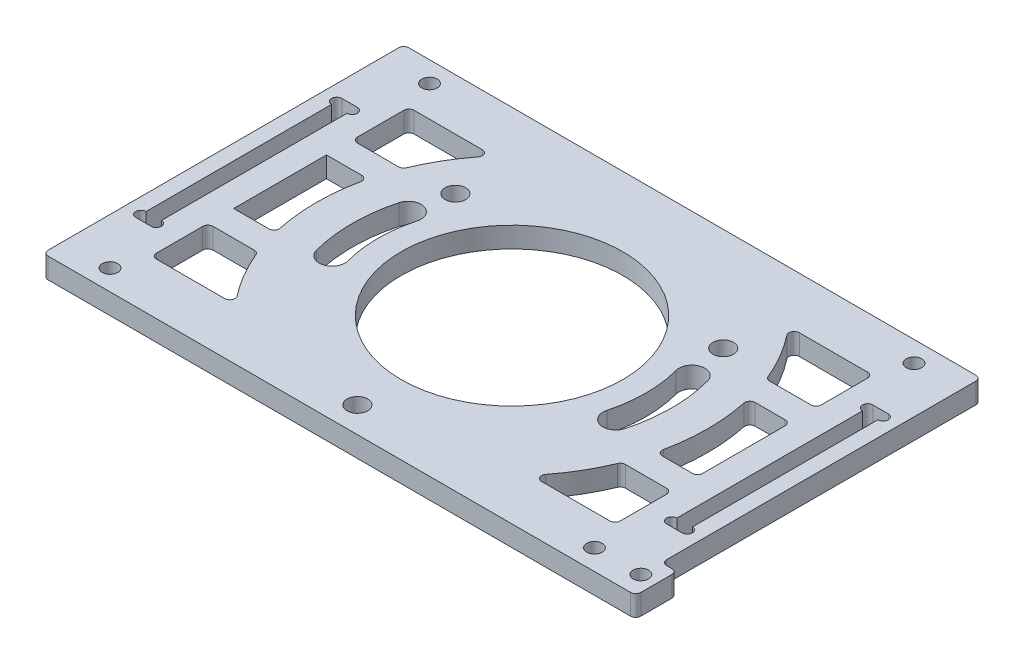
from build123d import *

# Parameters (mm, degrees)
SKETCH_1_W          = 112
SKETCH_1_H          = 70
SKETCH_1_W_2        = 3
SKETCH_1_H_2        = 40
EXTRUDE_1_DEPTH     = 4
SKETCH_6_R          = 21.5
SKETCH_6_R_2        = 2
CUT_EXTRUDE_5_DEPTH = 67.158899628
SKETCH_2_R          = 1.5
CUT_EXTRUDE_1_DEPTH = 10
SKETCH_4_R          = 1
CUT_EXTRUDE_3_DEPTH = 67.158899628
CUT_EXTRUDE_6_DEPTH = 67.158899628
SKETCH_8_W          = 3
SKETCH_8_H          = 8
EXTRUDE_2_DEPTH     = 4
SKETCH_9_R          = 1.5
CUT_EXTRUDE_7_DEPTH = 69.71681017
FILLET_3_R          = 1


with BuildPart() as part:
    # 草图1 → 凸台-拉伸1 (new body)
    with BuildSketch(Plane(origin=(0, 0, 0), x_dir=(1, 0, 0), z_dir=(0, 1, 0))):
        Rectangle(SKETCH_1_W, SKETCH_1_H)
        with Locations((-51.5, 0)):
            Rectangle(SKETCH_1_W_2, SKETCH_1_H_2, mode=Mode.SUBTRACT)
        with Locations((51.5, 0)):
            Rectangle(SKETCH_1_W_2, SKETCH_1_H_2, mode=Mode.SUBTRACT)
    extrude(amount=EXTRUDE_1_DEPTH)

    # 草图6 → 切除-拉伸5 (cut, through all)
    with BuildSketch(Plane(origin=(0, 4, 0), x_dir=(1, 0, 0), z_dir=(0, 1, 0))):
        with Locations(Location((0, 0, 0), (0, 0, 270))):
            Circle(SKETCH_6_R)
        with Locations(Location((-25.980762114, 15, 0), (0, 0, 270))):
            Circle(SKETCH_6_R_2)
        with Locations(Location((25.980762114, 15, 0), (0, 0, 270))):
            Circle(SKETCH_6_R_2)
        with Locations(Location((0, -30, 0), (0, 0, 270))):
            Circle(SKETCH_6_R_2)
        with BuildLine():
            ThreePointArc((-29.943700615, 8.023390398), (-31, 0), (-29.943700615, -8.023390398))
            ThreePointArc((-29.943700615, -8.023390398), (-26.881838436, -9.791157351), (-25.114071484, -6.729295173))
            ThreePointArc((-25.114071484, -6.729295173), (-26, 0), (-25.114071484, 6.729295173))
            ThreePointArc((-25.114071484, 6.729295173), (-26.881838436, 9.791157351), (-29.943700615, 8.023390398))
        make_face()
        with BuildLine():
            ThreePointArc((29.943700615, 8.023390398), (31, 0), (29.943700615, -8.023390398))
            ThreePointArc((29.943700615, -8.023390398), (26.881838436, -9.791157351), (25.114071484, -6.729295173))
            ThreePointArc((25.114071484, -6.729295173), (26, 0), (25.114071484, 6.729295173))
            ThreePointArc((25.114071484, 6.729295173), (26.881838436, 9.791157351), (29.943700615, 8.023390398))
        make_face()
    extrude(amount=-CUT_EXTRUDE_5_DEPTH, mode=Mode.SUBTRACT)

    # 草图2 → 切除-拉伸1 (cut)
    with BuildSketch(Plane(origin=(0, 4, 0), x_dir=(1, 0, 0), z_dir=(0, 1, 0))):
        with Locations(Location((-47, 31, 0), (0, 0, 270))):
            Circle(SKETCH_2_R)
        with Locations(Location((47, 31, 0), (0, 0, 270))):
            Circle(SKETCH_2_R)
        with Locations(Location((47, -31, 0), (0, 0, 270))):
            Circle(SKETCH_2_R)
        with Locations(Location((-47, -31, 0), (0, 0, 270))):
            Circle(SKETCH_2_R)
    extrude(amount=-CUT_EXTRUDE_1_DEPTH, mode=Mode.SUBTRACT)

    # 草图4 → 切除-拉伸3 (cut, through all)
    with BuildSketch(Plane.XZ.offset(-4)):
        with Locations((-50, 19)):
            Circle(SKETCH_4_R)
        with Locations((-50, -19)):
            Circle(SKETCH_4_R)
        with Locations((50, -19)):
            Circle(SKETCH_4_R)
        with Locations((50, 19)):
            Circle(SKETCH_4_R)
        with Locations((-53, 19)):
            Circle(SKETCH_4_R)
        with Locations((-53, -19)):
            Circle(SKETCH_4_R)
        with Locations((53, -19)):
            Circle(SKETCH_4_R)
        with Locations((53, 19)):
            Circle(SKETCH_4_R)
    extrude(amount=CUT_EXTRUDE_3_DEPTH, mode=Mode.SUBTRACT)

    # 草图7 → 切除-拉伸6 (cut, through all)
    with BuildSketch(Plane(origin=(0, 4, 0), x_dir=(1, 0, 0), z_dir=(0, 1, 0))):
        with BuildLine():
            Line((-28.618176043, 25), (-45, 25))
            Line((-45, 25), (-45, 14))
            Line((-45, 14), (-35.327043465, 14))
            ThreePointArc((-35.327043465, 14), (-32.442222095, 19.786415176), (-28.618176043, 25))
        make_face()
        with BuildLine():
            Line((-36.918829884, 9), (-45, 9))
            Line((-45, 9), (-45, -9))
            Line((-45, -9), (-36.918829884, -9))
            ThreePointArc((-36.918829884, -9), (-38, 0), (-36.918829884, 9))
        make_face()
        with BuildLine():
            Line((-45, -14), (-35.327043465, -14))
            ThreePointArc((-35.327043465, -14), (-32.442222095, -19.786415176), (-28.618176043, -25))
            Line((-28.618176043, -25), (-45, -25))
            Line((-45, -25), (-45, -14))
        make_face()
        with BuildLine():
            Line((28.618176043, -25), (45, -25))
            Line((45, -25), (45, -14))
            Line((45, -14), (35.327043465, -14))
            ThreePointArc((35.327043465, -14), (32.442222095, -19.786415176), (28.618176043, -25))
        make_face()
        with BuildLine():
            Line((36.918829884, -9), (45, -9))
            Line((45, -9), (45, 9))
            Line((45, 9), (36.918829884, 9))
            ThreePointArc((36.918829884, 9), (38, 0), (36.918829884, -9))
        make_face()
        with BuildLine():
            Line((45, 14), (35.327043465, 14))
            ThreePointArc((35.327043465, 14), (32.442222095, 19.786415176), (28.618176043, 25))
            Line((28.618176043, 25), (45, 25))
            Line((45, 25), (45, 14))
        make_face()
    extrude(amount=-CUT_EXTRUDE_6_DEPTH, mode=Mode.SUBTRACT)

    # 草图8 → 凸台-拉伸2 (add)
    with BuildSketch(Plane(origin=(0, 4, 0), x_dir=(1, 0, 0), z_dir=(0, 1, 0))):
        with Locations((57.5, -31)):
            Rectangle(SKETCH_8_W, SKETCH_8_H)
    extrude(amount=-EXTRUDE_2_DEPTH)

    # 草图9 → 切除-拉伸7 (cut, through all)
    with BuildSketch(Plane(origin=(0, 4, 0), x_dir=(1, 0, 0), z_dir=(0, 1, 0))):
        with Locations(Location((56, -31, 0), (0, 0, 270))):
            Circle(SKETCH_9_R)
    extrude(amount=-CUT_EXTRUDE_7_DEPTH, mode=Mode.SUBTRACT)

    # 圆角3
    fillet_3_edges = [part.edges().sort_by_distance(p)[0] for p in [
        (35.327043465, 2, -14),
        (28.618176043, 2, -25),
        (45, 2, -25),
        (45, 2, -14),
        (36.918829884, 2, 9),
        (36.918829884, 2, -9),
        (45, 2, -9),
        (45, 2, 9),
        (28.618176043, 2, 25),
        (35.327043465, 2, 14),
        (45, 2, 14),
        (45, 2, 25),
        (-35.327043465, 2, 14),
        (-28.618176043, 2, 25),
        (-45, 2, 25),
        (-45, 2, 14),
        (-36.918829884, 2, -9),
        (-36.918829884, 2, 9),
        (-28.618176043, 2, -25),
        (-35.327043465, 2, -14),
        (-45, 2, -14),
        (-45, 2, -25),
        (56, 2, 27),
        (59, 2, 27),
        (59, 2, 35),
        (-56, 2, -35),
        (56, 2, -35),
        (-56, 2, 35),
    ]]
    fillet(fillet_3_edges, radius=FILLET_3_R)


solid = part.part
